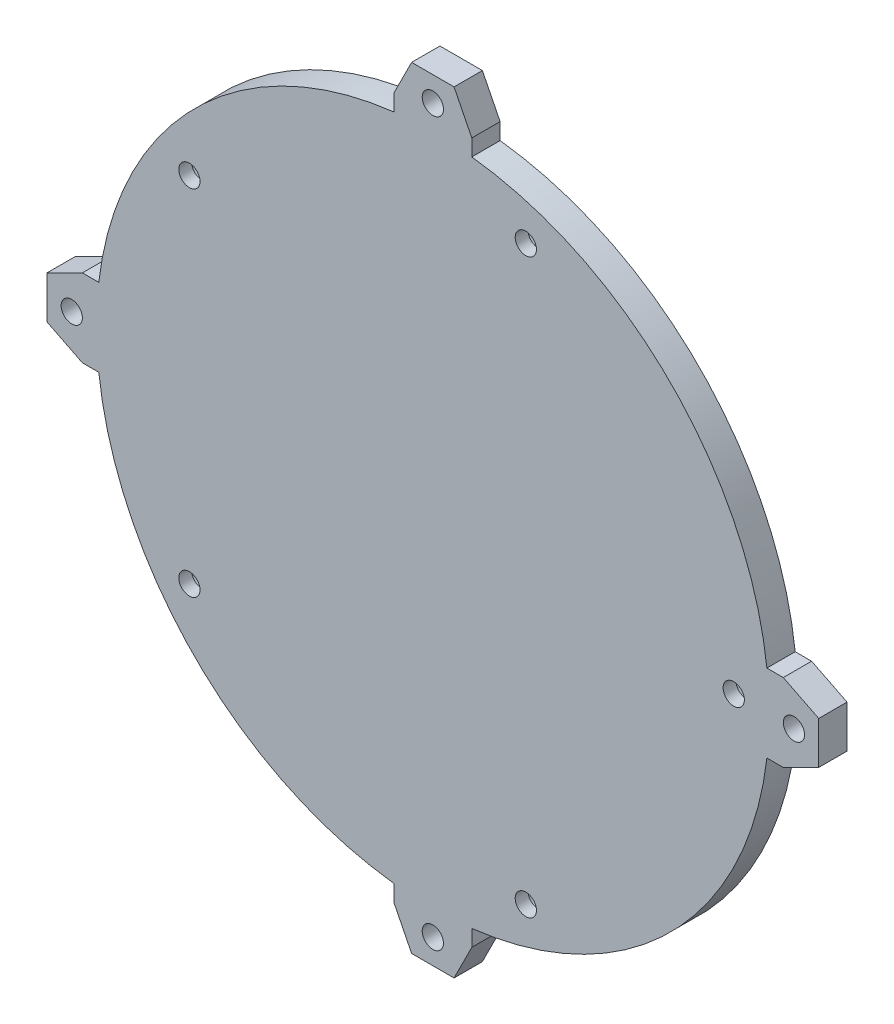
from build123d import *

# Parameters (mm, degrees)
SKETCH1_R           = 2.75
SKETCH1_R_2         = 1.5
BOSS_EXTRUDE2_DEPTH = 4
SKETCH1_4_R         = 2.75
SKETCH1_4_R_2       = 1.5
CUT_EXTRUDE1_DEPTH  = 2.2


with BuildPart() as part:
    # Sketch1 → Boss-Extrude2 (new body)
    # profile 1 of 6: a face of its own
    with BuildSketch(Plane.XY):
        with BuildLine():
            Line((60, 5), (60, 7.319495552))
            ThreePointArc((60, 7.319495552), (88.087572106, 20.912427894), (101.680504448, 49))
            Line((101.680504448, 49), (104, 49))
            Line((104, 49), (109, 51.5))
            Line((109, 51.5), (109, 57.5))
            Line((109, 57.5), (104, 60))
            Line((104, 60), (101.680504448, 60))
            ThreePointArc((101.680504448, 60), (88.087572106, 88.087572106), (60, 101.680504448))
            Line((60, 101.680504448), (60, 104))
            Line((60, 104), (57.5, 109))
            Line((57.5, 109), (51.5, 109))
            Line((51.5, 109), (49, 104))
            Line((49, 104), (49, 101.680504448))
            ThreePointArc((49, 101.680504448), (20.912427894, 88.087572106), (7.319495552, 60))
            Line((7.319495552, 60), (5, 60))
            Line((5, 60), (0, 57.5))
            Line((0, 57.5), (0, 51.5))
            Line((0, 51.5), (5, 49))
            Line((5, 49), (7.319495552, 49))
            ThreePointArc((7.319495552, 49), (20.912427894, 20.912427894), (49, 7.319495552))
            Line((49, 7.319495552), (49, 5))
            Line((49, 5), (51.5, 0))
            Line((51.5, 0), (57.5, 0))
            Line((57.5, 0), (60, 5))
        make_face()
        with Locations((67.633222261, 14.080098057)):
            Circle(SKETCH1_R, mode=Mode.SUBTRACT)
        with Locations((97, 54.5)):
            Circle(SKETCH1_R, mode=Mode.SUBTRACT)
        with Locations((67.633222261, 94.919901943)):
            Circle(SKETCH1_R, mode=Mode.SUBTRACT)
        with Locations((20.116777739, 29.519126778)):
            Circle(SKETCH1_R, mode=Mode.SUBTRACT)
        with Locations((20.116777739, 79.480873222)):
            Circle(SKETCH1_R, mode=Mode.SUBTRACT)
        with Locations((54.5, 105.5)):
            Circle(SKETCH1_R_2, mode=Mode.SUBTRACT)
        with Locations((105.5, 54.5)):
            Circle(SKETCH1_R_2, mode=Mode.SUBTRACT)
        with Locations((3.5, 54.5)):
            Circle(SKETCH1_R_2, mode=Mode.SUBTRACT)
        with Locations((54.5, 3.5)):
            Circle(SKETCH1_R_2, mode=Mode.SUBTRACT)
    # profile 2 of 6: a face of its own
    with BuildSketch(Plane.XY):
        with Locations((20.116777739, 79.480873222)):
            Circle(SKETCH1_R)
        with Locations((20.116777739, 79.480873222)):
            Circle(SKETCH1_R_2, mode=Mode.SUBTRACT)
    # profile 3 of 6: a face of its own
    with BuildSketch(Plane.XY):
        with Locations((67.633222261, 94.919901943)):
            Circle(SKETCH1_R)
        with Locations((67.633222261, 94.919901943)):
            Circle(SKETCH1_R_2, mode=Mode.SUBTRACT)
    # profile 4 of 6: a face of its own
    with BuildSketch(Plane.XY):
        with Locations((97, 54.5)):
            Circle(SKETCH1_R)
        with Locations((97, 54.5)):
            Circle(SKETCH1_R_2, mode=Mode.SUBTRACT)
    # profile 5 of 6: a face of its own
    with BuildSketch(Plane.XY):
        with Locations((67.633222261, 14.080098057)):
            Circle(SKETCH1_R)
        with Locations((67.633222261, 14.080098057)):
            Circle(SKETCH1_R_2, mode=Mode.SUBTRACT)
    # profile 6 of 6: a face of its own
    with BuildSketch(Plane.XY):
        with Locations((20.116777739, 29.519126778)):
            Circle(SKETCH1_R)
        with Locations((20.116777739, 29.519126778)):
            Circle(SKETCH1_R_2, mode=Mode.SUBTRACT)
    extrude(amount=BOSS_EXTRUDE2_DEPTH)

    # Sketch1<4> → Cut-Extrude1 (cut)
    # profile 1 of 5: a face of its own
    with BuildSketch(Plane.XY):
        with Locations((20.116777739, 29.519126778)):
            Circle(SKETCH1_4_R)
        with Locations((20.116777739, 29.519126778)):
            Circle(SKETCH1_4_R_2, mode=Mode.SUBTRACT)
    # profile 2 of 5: a face of its own
    with BuildSketch(Plane.XY):
        with Locations((67.633222261, 14.080098057)):
            Circle(SKETCH1_4_R)
        with Locations((67.633222261, 14.080098057)):
            Circle(SKETCH1_4_R_2, mode=Mode.SUBTRACT)
    # profile 3 of 5: a face of its own
    with BuildSketch(Plane.XY):
        with Locations((97, 54.5)):
            Circle(SKETCH1_4_R)
        with Locations((97, 54.5)):
            Circle(SKETCH1_4_R_2, mode=Mode.SUBTRACT)
    # profile 4 of 5: a face of its own
    with BuildSketch(Plane.XY):
        with Locations((67.633222261, 94.919901943)):
            Circle(SKETCH1_4_R)
        with Locations((67.633222261, 94.919901943)):
            Circle(SKETCH1_4_R_2, mode=Mode.SUBTRACT)
    # profile 5 of 5: a face of its own
    with BuildSketch(Plane.XY):
        with Locations((20.116777739, 79.480873222)):
            Circle(SKETCH1_4_R)
        with Locations((20.116777739, 79.480873222)):
            Circle(SKETCH1_4_R_2, mode=Mode.SUBTRACT)
    extrude(amount=CUT_EXTRUDE1_DEPTH, mode=Mode.SUBTRACT)


solid = part.part
